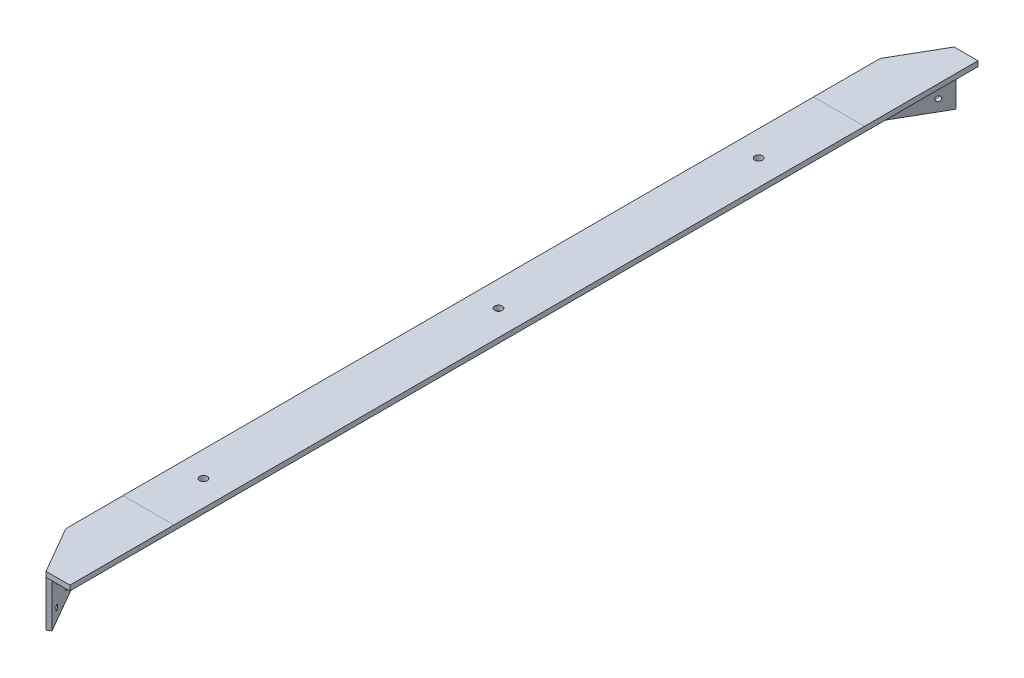
from build123d import *

# Parameters (mm, degrees)
BOSS_EXTRUDE1_DEPTH  = 640
BOSS_EXTRUDE2_DEPTH  = 8
BOSS_EXTRUDE3_DEPTH  = 72
SKETCH6_R            = 4
CUT_EXTRUDE1_DEPTH   = 8
FILLET1_R            = 10
FILLET2_R            = 8
FILLET1_OF_MIRROR1_R = 10
FILLET2_OF_MIRROR1_R = 8
SKETCH8_R            = 6
CUT_EXTRUDE2_DEPTH   = 8


with BuildPart() as part:
    # Sketch1 → Boss-Extrude1 (new body)
    with BuildSketch(Plane.XY):
        Polygon((-8, 8), (72, 8), (72, 0), (0, 0), (0, -72), (-8, -72), align=None)
    boss_extrude1 = extrude(amount=BOSS_EXTRUDE1_DEPTH)

    # Sketch3 → Boss-Extrude2 (add)
    with BuildSketch(Plane(origin=(0, 0, 0), x_dir=(1, 0, 0), z_dir=(0, 1, 0))):
        Polygon((-8, -640), (34.5, -713.612159322), (72, -713.612159322), (72, -640), align=None)
    boss_extrude2 = extrude(amount=BOSS_EXTRUDE2_DEPTH)

    # Sketch4 → Boss-Extrude3 (add)
    with BuildSketch(Plane.XZ):
        Polygon((-8, 640), (34.5, 713.612159322), (40.5, 710.148057707), (0, 640), align=None)
    boss_extrude3 = extrude(amount=BOSS_EXTRUDE3_DEPTH)

    # Sketch6 → Cut-Extrude1 (cut)
    with BuildSketch(Plane(origin=(-277.128129211, 0, 160), x_dir=(-0.4999999999999956, 0, -0.8660254037844413), z_dir=(0.8660254037844413, 0, -0.4999999999999956))):
        with Locations((-615.006258422, -18)):
            Circle(SKETCH6_R)
        with Locations((-574.506258422, -18)):
            Circle(SKETCH6_R)
        with Locations((-574.506258422, -54)):
            Circle(SKETCH6_R)
        with Locations((-615.006258422, -54)):
            Circle(SKETCH6_R)
    cut_extrude1 = extrude(amount=-CUT_EXTRUDE1_DEPTH, mode=Mode.SUBTRACT)

    # Fillet1
    fillet1_edges = [part.edges().sort_by_distance(p)[0] for p in [
        (0, -36, 640),
        (-8, -32, 640),
    ]]
    fillet(fillet1_edges, radius=FILLET1_R)

    # Fillet2
    fillet2_edges = [part.edges().sort_by_distance(p)[0] for p in [
        (20.919872981, 0, 676.234282891),
        (0, 0, 318.660254038),
        (0.340741737, 0, 639.908698527),
    ]]
    fillet(fillet2_edges, radius=FILLET2_R)

    # Mirror1: Boss-Extrude1, Boss-Extrude2, Boss-Extrude3, Cut-Extrude1 across plane
    add(boss_extrude1.mirror(Plane.XY))
    add(boss_extrude2.mirror(Plane.XY))
    add(boss_extrude3.mirror(Plane.XY))
    add(cut_extrude1.mirror(Plane.XY), mode=Mode.SUBTRACT)

    # Fillet1 of Mirror1
    fillet1_of_mirror1_edges = [part.edges().sort_by_distance(p)[0] for p in [
        (0, -36, -640),
        (-8, -32, -640),
    ]]
    fillet(fillet1_of_mirror1_edges, radius=FILLET1_OF_MIRROR1_R)

    # Fillet2 of Mirror1
    fillet2_of_mirror1_edges = [part.edges().sort_by_distance(p)[0] for p in [
        (20.919872981, 0, -676.234282891),
        (0, 0, -318.660254038),
        (0.340741737, 0, -639.908698527),
    ]]
    fillet(fillet2_of_mirror1_edges, radius=FILLET2_OF_MIRROR1_R)

    # Sketch8 → Cut-Extrude2 (cut)
    with BuildSketch(Plane(origin=(0, 8, 0), x_dir=(1, 0, 0), z_dir=(0, 1, 0))):
        with Locations(Location((32, 408.88990362, 0), (0, 0, 180))):
            Circle(SKETCH8_R)
        with Locations(Location((32, 0, 0), (0, 0, 180))):
            Circle(SKETCH8_R)
        with Locations(Location((32, -463.612159322, 0), (0, 0, 180))):
            Circle(SKETCH8_R)
    extrude(amount=-CUT_EXTRUDE2_DEPTH, mode=Mode.SUBTRACT)


solid = part.part
